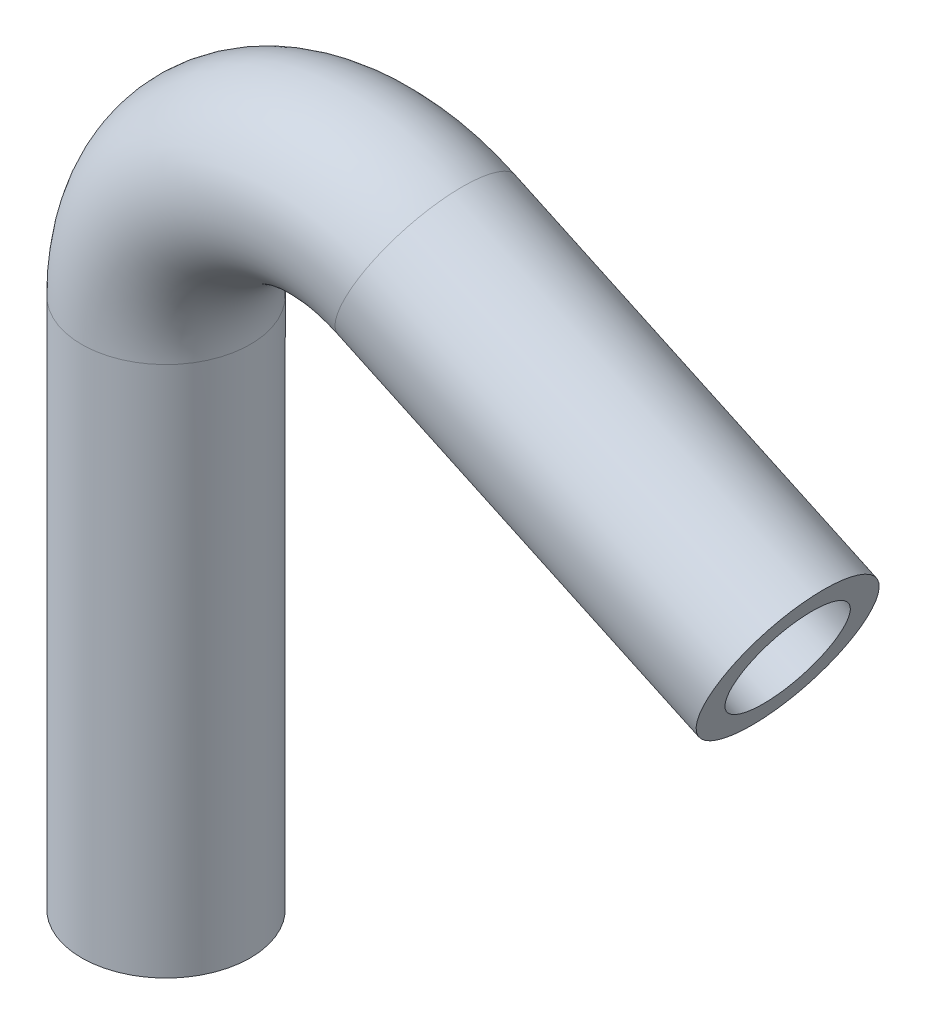
from build123d import *

# Parameters (mm, degrees)
SWEEP_SOTTILE1_PROFILE_R   = 3.175
SWEEP_SOTTILE1_PROFILE_R_2 = 2.175


with BuildPart() as part:
    # Sweep-Sottile1: sweep along a path in Schizzo1
    with BuildLine(Plane.XY) as sweep_sottile1_path:
        Line((0, 0), (0, 20))
        ThreePointArc((0, 20), (3.189533949, 25.813752694), (9.80653858, 26.247454091))
        Line((9.80653858, 26.247454091), (23.401155386, 19.908180165))
    # Sweep-Sottile1 profile (on start of the path) → Sweep-Sottile1 (sweep)
    with BuildSketch(Plane.ZX):
        Circle(SWEEP_SOTTILE1_PROFILE_R)
        Circle(SWEEP_SOTTILE1_PROFILE_R_2, mode=Mode.SUBTRACT)
    sweep(path=sweep_sottile1_path.line)


solid = part.part
